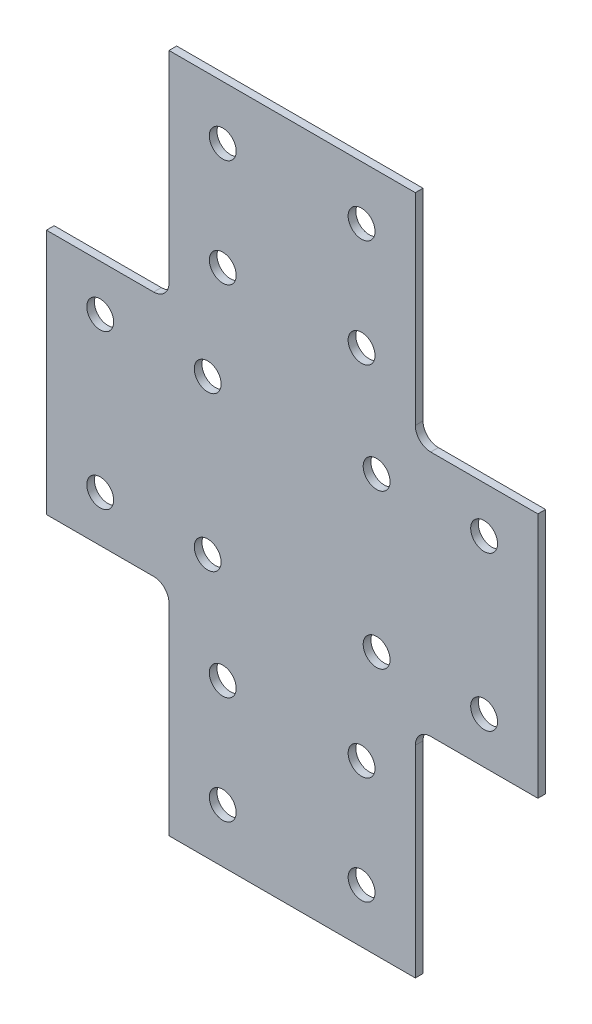
from build123d import *

# Parameters (mm, degrees)
SKETCH1_R           = 11.1125
BOSS_EXTRUDE1_DEPTH = 6.35
FILLET1_R           = 12.7


with BuildPart() as part:
    # Sketch1 → Boss-Extrude1 (new body)
    with BuildSketch(Plane.XY):
        Polygon((20.207363698, 1349.509753019), (-183.500636302, 1349.509753019), (-183.500636302, 1528.897253019), (-284.846636302, 1528.897253019), (-284.846636302, 1732.605253019), (-183.500636302, 1732.605253019), (-183.500636302, 1911.992753019), (20.207363698, 1911.992753019), (20.207363698, 1732.605253019), (121.553363698, 1732.605253019), (121.553363698, 1528.897253019), (20.207363698, 1528.897253019), align=None)
        with Locations((-139.050636302, 1867.542753019)):
            Circle(SKETCH1_R, mode=Mode.SUBTRACT)
        with Locations((-151.496636302, 1694.505253019)):
            Circle(SKETCH1_R, mode=Mode.SUBTRACT)
        with Locations(Location((-11.796636302, 1694.505253019, 0), (0, 0, 180))):
            Circle(SKETCH1_R, mode=Mode.SUBTRACT)
        with Locations(Location((-24.242636302, 1867.542753019, 0), (0, 0, 180))):
            Circle(SKETCH1_R, mode=Mode.SUBTRACT)
        with Locations((-24.242636302, 1393.959753019)):
            Circle(SKETCH1_R, mode=Mode.SUBTRACT)
        with Locations(Location((-139.050636302, 1393.959753019, 0), (0, 0, 180))):
            Circle(SKETCH1_R, mode=Mode.SUBTRACT)
        with Locations(Location((-151.496636302, 1566.997253019, 0), (0, 0, 180))):
            Circle(SKETCH1_R, mode=Mode.SUBTRACT)
        with Locations((-11.796636302, 1566.997253019)):
            Circle(SKETCH1_R, mode=Mode.SUBTRACT)
        with Locations((-240.396636302, 1694.505253019)):
            Circle(SKETCH1_R, mode=Mode.SUBTRACT)
        with Locations((-139.050636302, 1778.642753019)):
            Circle(SKETCH1_R, mode=Mode.SUBTRACT)
        with Locations(Location((-139.050636302, 1482.859753019, 0), (0, 0, 180))):
            Circle(SKETCH1_R, mode=Mode.SUBTRACT)
        with Locations(Location((-240.396636302, 1566.997253019, 0), (0, 0, 180))):
            Circle(SKETCH1_R, mode=Mode.SUBTRACT)
        with Locations(Location((-24.242636302, 1778.642753019, 0), (0, 0, 180))):
            Circle(SKETCH1_R, mode=Mode.SUBTRACT)
        with Locations(Location((77.103363698, 1694.505253019, 0), (0, 0, 180))):
            Circle(SKETCH1_R, mode=Mode.SUBTRACT)
        with Locations((77.103363698, 1566.997253019)):
            Circle(SKETCH1_R, mode=Mode.SUBTRACT)
        with Locations((-24.242636302, 1482.859753019)):
            Circle(SKETCH1_R, mode=Mode.SUBTRACT)
    extrude(amount=BOSS_EXTRUDE1_DEPTH)

    # Fillet1
    fillet1_edges = [part.edges().sort_by_distance(p)[0] for p in [
        (-183.500636302, 1528.897253019, 3.175),
        (-183.500636302, 1732.605253019, 3.175),
        (20.207363698, 1732.605253019, 3.175),
        (20.207363698, 1528.897253019, 3.175),
    ]]
    fillet(fillet1_edges, radius=FILLET1_R)


solid = part.part
